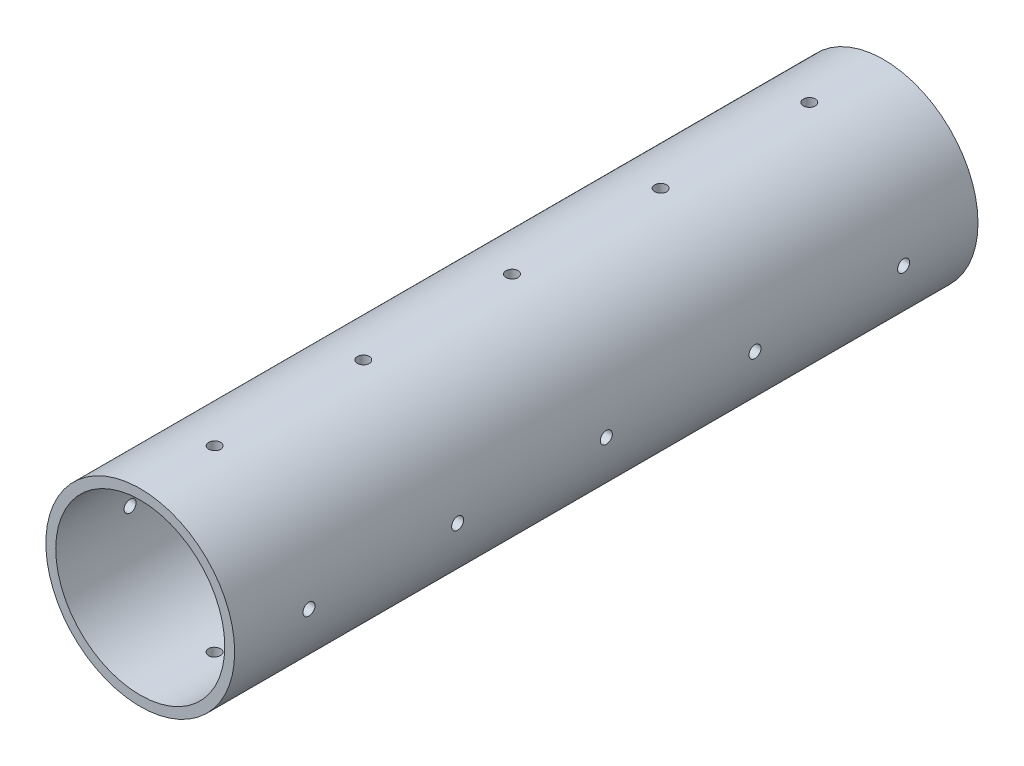
from build123d import *

# Parameters (mm, degrees)
SKETCH1_R                           = 15.875
SKETCH1_R_2                         = 14.210807843
BOSS_EXTRUDE1_DEPTH                 = 125
CUT_EXTRUDE1_REACH                  = 129
CUT_EXTRUDE1_END_RADIUS             = 15.875
SKETCH2_R                           = 1.0125
CUT_EXTRUDE1_DIRECTION_2_REACH      = 129
CUT_EXTRUDE1_DIRECTION_2_END_RADIUS = 15.875
CUT_EXTRUDE2_REACH                  = 129
CUT_EXTRUDE2_END_RADIUS             = 15.875
SKETCH3_R                           = 1.0125
CUT_EXTRUDE2_DIRECTION_2_REACH      = 129
CUT_EXTRUDE2_DIRECTION_2_END_RADIUS = 15.875


with BuildPart() as part:
    # Sketch1 → Boss-Extrude1 (new body)
    with BuildSketch(Plane.XY):
        Circle(SKETCH1_R)
        Circle(SKETCH1_R_2, mode=Mode.SUBTRACT)
    extrude(amount=BOSS_EXTRUDE1_DEPTH)

    # Cut-Extrude1: up to this cylinder (the profile starts inside it)
    cut_extrude1_end = Plane(origin=(0, 0, 150), z_dir=(0, 0, -1)) * Cylinder(CUT_EXTRUDE1_END_RADIUS, 565.75, mode=Mode.PRIVATE)
    # Sketch2 → Cut-Extrude1 (cut, up to the surface)
    with BuildSketch(Plane(origin=(0, 0, 0), x_dir=(1, 0, 0), z_dir=(0, 1, 0)), mode=Mode.PRIVATE) as cut_extrude1_sk1:
        with Locations(Location((0, -12.5, 0), (0, 0, 270))):
            Circle(SKETCH2_R)
    cut_extrude1_tool1 = extrude(cut_extrude1_sk1.sketch, amount=-CUT_EXTRUDE1_REACH, mode=Mode.PRIVATE) & cut_extrude1_end
    add(cut_extrude1_tool1.solids().sort_by_distance((0, 0, 12.5))[0], mode=Mode.SUBTRACT)
    # Sketch2 → Cut-Extrude1 (cut, up to the surface)
    with BuildSketch(Plane(origin=(0, 0, 0), x_dir=(1, 0, 0), z_dir=(0, 1, 0)), mode=Mode.PRIVATE) as cut_extrude1_sk2:
        with Locations(Location((0, -37.5, 0), (0, 0, 270))):
            Circle(SKETCH2_R)
    cut_extrude1_tool2 = extrude(cut_extrude1_sk2.sketch, amount=-CUT_EXTRUDE1_REACH, mode=Mode.PRIVATE) & cut_extrude1_end
    add(cut_extrude1_tool2.solids().sort_by_distance((0, 0, 37.5))[0], mode=Mode.SUBTRACT)
    # Sketch2 → Cut-Extrude1 (cut, up to the surface)
    with BuildSketch(Plane(origin=(0, 0, 0), x_dir=(1, 0, 0), z_dir=(0, 1, 0)), mode=Mode.PRIVATE) as cut_extrude1_sk3:
        with Locations(Location((0, -62.5, 0), (0, 0, 270))):
            Circle(SKETCH2_R)
    cut_extrude1_tool3 = extrude(cut_extrude1_sk3.sketch, amount=-CUT_EXTRUDE1_REACH, mode=Mode.PRIVATE) & cut_extrude1_end
    add(cut_extrude1_tool3.solids().sort_by_distance((0, 0, 62.5))[0], mode=Mode.SUBTRACT)
    # Sketch2 → Cut-Extrude1 (cut, up to the surface)
    with BuildSketch(Plane(origin=(0, 0, 0), x_dir=(1, 0, 0), z_dir=(0, 1, 0)), mode=Mode.PRIVATE) as cut_extrude1_sk4:
        with Locations(Location((0, -87.5, 0), (0, 0, 270))):
            Circle(SKETCH2_R)
    cut_extrude1_tool4 = extrude(cut_extrude1_sk4.sketch, amount=-CUT_EXTRUDE1_REACH, mode=Mode.PRIVATE) & cut_extrude1_end
    add(cut_extrude1_tool4.solids().sort_by_distance((0, 0, 87.5))[0], mode=Mode.SUBTRACT)
    # Sketch2 → Cut-Extrude1 (cut, up to the surface)
    with BuildSketch(Plane(origin=(0, 0, 0), x_dir=(1, 0, 0), z_dir=(0, 1, 0)), mode=Mode.PRIVATE) as cut_extrude1_sk5:
        with Locations(Location((0, -112.5, 0), (0, 0, 270))):
            Circle(SKETCH2_R)
    cut_extrude1_tool5 = extrude(cut_extrude1_sk5.sketch, amount=-CUT_EXTRUDE1_REACH, mode=Mode.PRIVATE) & cut_extrude1_end
    add(cut_extrude1_tool5.solids().sort_by_distance((0, 0, 112.5))[0], mode=Mode.SUBTRACT)
    # Sketch2 → Cut-Extrude1 (cut, up to the surface)
    with BuildSketch(Plane(origin=(0, 0, 0), x_dir=(1, 0, 0), z_dir=(0, 1, 0)), mode=Mode.PRIVATE) as cut_extrude1_sk6:
        with Locations((0, -137.5)):
            Circle(SKETCH2_R)
    cut_extrude1_tool6 = extrude(cut_extrude1_sk6.sketch, amount=-CUT_EXTRUDE1_REACH, mode=Mode.PRIVATE) & cut_extrude1_end
    add(cut_extrude1_tool6.solids().sort_by_distance((0, 0, 137.5))[0], mode=Mode.SUBTRACT)
    # Sketch2 → Cut-Extrude1 (cut, up to the surface)
    with BuildSketch(Plane(origin=(0, 0, 0), x_dir=(1, 0, 0), z_dir=(0, 1, 0)), mode=Mode.PRIVATE) as cut_extrude1_sk7:
        with Locations((0, -162.5)):
            Circle(SKETCH2_R)
    cut_extrude1_tool7 = extrude(cut_extrude1_sk7.sketch, amount=-CUT_EXTRUDE1_REACH, mode=Mode.PRIVATE) & cut_extrude1_end
    add(cut_extrude1_tool7.solids().sort_by_distance((0, 0, 162.5))[0], mode=Mode.SUBTRACT)
    # Sketch2 → Cut-Extrude1 (cut, up to the surface)
    with BuildSketch(Plane(origin=(0, 0, 0), x_dir=(1, 0, 0), z_dir=(0, 1, 0)), mode=Mode.PRIVATE) as cut_extrude1_sk8:
        with Locations((0, -187.5)):
            Circle(SKETCH2_R)
    cut_extrude1_tool8 = extrude(cut_extrude1_sk8.sketch, amount=-CUT_EXTRUDE1_REACH, mode=Mode.PRIVATE) & cut_extrude1_end
    add(cut_extrude1_tool8.solids().sort_by_distance((0, 0, 187.5))[0], mode=Mode.SUBTRACT)
    # Sketch2 → Cut-Extrude1 (cut, up to the surface)
    with BuildSketch(Plane(origin=(0, 0, 0), x_dir=(1, 0, 0), z_dir=(0, 1, 0)), mode=Mode.PRIVATE) as cut_extrude1_sk9:
        with Locations((0, -212.5)):
            Circle(SKETCH2_R)
    cut_extrude1_tool9 = extrude(cut_extrude1_sk9.sketch, amount=-CUT_EXTRUDE1_REACH, mode=Mode.PRIVATE) & cut_extrude1_end
    add(cut_extrude1_tool9.solids().sort_by_distance((0, 0, 212.5))[0], mode=Mode.SUBTRACT)
    # Sketch2 → Cut-Extrude1 (cut, up to the surface)
    with BuildSketch(Plane(origin=(0, 0, 0), x_dir=(1, 0, 0), z_dir=(0, 1, 0)), mode=Mode.PRIVATE) as cut_extrude1_sk10:
        with Locations((0, -237.5)):
            Circle(SKETCH2_R)
    cut_extrude1_tool10 = extrude(cut_extrude1_sk10.sketch, amount=-CUT_EXTRUDE1_REACH, mode=Mode.PRIVATE) & cut_extrude1_end
    add(cut_extrude1_tool10.solids().sort_by_distance((0, 0, 237.5))[0], mode=Mode.SUBTRACT)
    # Sketch2 → Cut-Extrude1 (cut, up to the surface)
    with BuildSketch(Plane(origin=(0, 0, 0), x_dir=(1, 0, 0), z_dir=(0, 1, 0)), mode=Mode.PRIVATE) as cut_extrude1_sk11:
        with Locations((0, -262.5)):
            Circle(SKETCH2_R)
    cut_extrude1_tool11 = extrude(cut_extrude1_sk11.sketch, amount=-CUT_EXTRUDE1_REACH, mode=Mode.PRIVATE) & cut_extrude1_end
    add(cut_extrude1_tool11.solids().sort_by_distance((0, 0, 262.5))[0], mode=Mode.SUBTRACT)
    # Sketch2 → Cut-Extrude1 (cut, up to the surface)
    with BuildSketch(Plane(origin=(0, 0, 0), x_dir=(1, 0, 0), z_dir=(0, 1, 0)), mode=Mode.PRIVATE) as cut_extrude1_sk12:
        with Locations((0, -287.5)):
            Circle(SKETCH2_R)
    cut_extrude1_tool12 = extrude(cut_extrude1_sk12.sketch, amount=-CUT_EXTRUDE1_REACH, mode=Mode.PRIVATE) & cut_extrude1_end
    add(cut_extrude1_tool12.solids().sort_by_distance((0, 0, 287.5))[0], mode=Mode.SUBTRACT)

    # Cut-Extrude1 direction 2: up to this cylinder (the profile starts inside it)
    cut_extrude1_direction_2_end = Plane(origin=(0, 0, 150), z_dir=(0, 0, -1)) * Cylinder(CUT_EXTRUDE1_DIRECTION_2_END_RADIUS, 565.75, mode=Mode.PRIVATE)
    # Sketch2 → Cut-Extrude1 direction 2 (cut, up to the surface)
    with BuildSketch(Plane(origin=(0, 0, 0), x_dir=(1, 0, 0), z_dir=(0, 1, 0)), mode=Mode.PRIVATE) as cut_extrude1_direction_2_sk1:
        with Locations(Location((0, -12.5, 0), (0, 0, 270))):
            Circle(SKETCH2_R)
    cut_extrude1_direction_2_tool1 = extrude(cut_extrude1_direction_2_sk1.sketch, amount=CUT_EXTRUDE1_DIRECTION_2_REACH, mode=Mode.PRIVATE) & cut_extrude1_direction_2_end
    add(cut_extrude1_direction_2_tool1.solids().sort_by_distance((0, 0, 12.5))[0], mode=Mode.SUBTRACT)
    # Sketch2 → Cut-Extrude1 direction 2 (cut, up to the surface)
    with BuildSketch(Plane(origin=(0, 0, 0), x_dir=(1, 0, 0), z_dir=(0, 1, 0)), mode=Mode.PRIVATE) as cut_extrude1_direction_2_sk2:
        with Locations(Location((0, -37.5, 0), (0, 0, 270))):
            Circle(SKETCH2_R)
    cut_extrude1_direction_2_tool2 = extrude(cut_extrude1_direction_2_sk2.sketch, amount=CUT_EXTRUDE1_DIRECTION_2_REACH, mode=Mode.PRIVATE) & cut_extrude1_direction_2_end
    add(cut_extrude1_direction_2_tool2.solids().sort_by_distance((0, 0, 37.5))[0], mode=Mode.SUBTRACT)
    # Sketch2 → Cut-Extrude1 direction 2 (cut, up to the surface)
    with BuildSketch(Plane(origin=(0, 0, 0), x_dir=(1, 0, 0), z_dir=(0, 1, 0)), mode=Mode.PRIVATE) as cut_extrude1_direction_2_sk3:
        with Locations(Location((0, -62.5, 0), (0, 0, 270))):
            Circle(SKETCH2_R)
    cut_extrude1_direction_2_tool3 = extrude(cut_extrude1_direction_2_sk3.sketch, amount=CUT_EXTRUDE1_DIRECTION_2_REACH, mode=Mode.PRIVATE) & cut_extrude1_direction_2_end
    add(cut_extrude1_direction_2_tool3.solids().sort_by_distance((0, 0, 62.5))[0], mode=Mode.SUBTRACT)
    # Sketch2 → Cut-Extrude1 direction 2 (cut, up to the surface)
    with BuildSketch(Plane(origin=(0, 0, 0), x_dir=(1, 0, 0), z_dir=(0, 1, 0)), mode=Mode.PRIVATE) as cut_extrude1_direction_2_sk4:
        with Locations(Location((0, -87.5, 0), (0, 0, 270))):
            Circle(SKETCH2_R)
    cut_extrude1_direction_2_tool4 = extrude(cut_extrude1_direction_2_sk4.sketch, amount=CUT_EXTRUDE1_DIRECTION_2_REACH, mode=Mode.PRIVATE) & cut_extrude1_direction_2_end
    add(cut_extrude1_direction_2_tool4.solids().sort_by_distance((0, 0, 87.5))[0], mode=Mode.SUBTRACT)
    # Sketch2 → Cut-Extrude1 direction 2 (cut, up to the surface)
    with BuildSketch(Plane(origin=(0, 0, 0), x_dir=(1, 0, 0), z_dir=(0, 1, 0)), mode=Mode.PRIVATE) as cut_extrude1_direction_2_sk5:
        with Locations(Location((0, -112.5, 0), (0, 0, 270))):
            Circle(SKETCH2_R)
    cut_extrude1_direction_2_tool5 = extrude(cut_extrude1_direction_2_sk5.sketch, amount=CUT_EXTRUDE1_DIRECTION_2_REACH, mode=Mode.PRIVATE) & cut_extrude1_direction_2_end
    add(cut_extrude1_direction_2_tool5.solids().sort_by_distance((0, 0, 112.5))[0], mode=Mode.SUBTRACT)
    # Sketch2 → Cut-Extrude1 direction 2 (cut, up to the surface)
    with BuildSketch(Plane(origin=(0, 0, 0), x_dir=(1, 0, 0), z_dir=(0, 1, 0)), mode=Mode.PRIVATE) as cut_extrude1_direction_2_sk6:
        with Locations((0, -137.5)):
            Circle(SKETCH2_R)
    cut_extrude1_direction_2_tool6 = extrude(cut_extrude1_direction_2_sk6.sketch, amount=CUT_EXTRUDE1_DIRECTION_2_REACH, mode=Mode.PRIVATE) & cut_extrude1_direction_2_end
    add(cut_extrude1_direction_2_tool6.solids().sort_by_distance((0, 0, 137.5))[0], mode=Mode.SUBTRACT)
    # Sketch2 → Cut-Extrude1 direction 2 (cut, up to the surface)
    with BuildSketch(Plane(origin=(0, 0, 0), x_dir=(1, 0, 0), z_dir=(0, 1, 0)), mode=Mode.PRIVATE) as cut_extrude1_direction_2_sk7:
        with Locations((0, -162.5)):
            Circle(SKETCH2_R)
    cut_extrude1_direction_2_tool7 = extrude(cut_extrude1_direction_2_sk7.sketch, amount=CUT_EXTRUDE1_DIRECTION_2_REACH, mode=Mode.PRIVATE) & cut_extrude1_direction_2_end
    add(cut_extrude1_direction_2_tool7.solids().sort_by_distance((0, 0, 162.5))[0], mode=Mode.SUBTRACT)
    # Sketch2 → Cut-Extrude1 direction 2 (cut, up to the surface)
    with BuildSketch(Plane(origin=(0, 0, 0), x_dir=(1, 0, 0), z_dir=(0, 1, 0)), mode=Mode.PRIVATE) as cut_extrude1_direction_2_sk8:
        with Locations((0, -187.5)):
            Circle(SKETCH2_R)
    cut_extrude1_direction_2_tool8 = extrude(cut_extrude1_direction_2_sk8.sketch, amount=CUT_EXTRUDE1_DIRECTION_2_REACH, mode=Mode.PRIVATE) & cut_extrude1_direction_2_end
    add(cut_extrude1_direction_2_tool8.solids().sort_by_distance((0, 0, 187.5))[0], mode=Mode.SUBTRACT)
    # Sketch2 → Cut-Extrude1 direction 2 (cut, up to the surface)
    with BuildSketch(Plane(origin=(0, 0, 0), x_dir=(1, 0, 0), z_dir=(0, 1, 0)), mode=Mode.PRIVATE) as cut_extrude1_direction_2_sk9:
        with Locations((0, -212.5)):
            Circle(SKETCH2_R)
    cut_extrude1_direction_2_tool9 = extrude(cut_extrude1_direction_2_sk9.sketch, amount=CUT_EXTRUDE1_DIRECTION_2_REACH, mode=Mode.PRIVATE) & cut_extrude1_direction_2_end
    add(cut_extrude1_direction_2_tool9.solids().sort_by_distance((0, 0, 212.5))[0], mode=Mode.SUBTRACT)
    # Sketch2 → Cut-Extrude1 direction 2 (cut, up to the surface)
    with BuildSketch(Plane(origin=(0, 0, 0), x_dir=(1, 0, 0), z_dir=(0, 1, 0)), mode=Mode.PRIVATE) as cut_extrude1_direction_2_sk10:
        with Locations((0, -237.5)):
            Circle(SKETCH2_R)
    cut_extrude1_direction_2_tool10 = extrude(cut_extrude1_direction_2_sk10.sketch, amount=CUT_EXTRUDE1_DIRECTION_2_REACH, mode=Mode.PRIVATE) & cut_extrude1_direction_2_end
    add(cut_extrude1_direction_2_tool10.solids().sort_by_distance((0, 0, 237.5))[0], mode=Mode.SUBTRACT)
    # Sketch2 → Cut-Extrude1 direction 2 (cut, up to the surface)
    with BuildSketch(Plane(origin=(0, 0, 0), x_dir=(1, 0, 0), z_dir=(0, 1, 0)), mode=Mode.PRIVATE) as cut_extrude1_direction_2_sk11:
        with Locations((0, -262.5)):
            Circle(SKETCH2_R)
    cut_extrude1_direction_2_tool11 = extrude(cut_extrude1_direction_2_sk11.sketch, amount=CUT_EXTRUDE1_DIRECTION_2_REACH, mode=Mode.PRIVATE) & cut_extrude1_direction_2_end
    add(cut_extrude1_direction_2_tool11.solids().sort_by_distance((0, 0, 262.5))[0], mode=Mode.SUBTRACT)
    # Sketch2 → Cut-Extrude1 direction 2 (cut, up to the surface)
    with BuildSketch(Plane(origin=(0, 0, 0), x_dir=(1, 0, 0), z_dir=(0, 1, 0)), mode=Mode.PRIVATE) as cut_extrude1_direction_2_sk12:
        with Locations((0, -287.5)):
            Circle(SKETCH2_R)
    cut_extrude1_direction_2_tool12 = extrude(cut_extrude1_direction_2_sk12.sketch, amount=CUT_EXTRUDE1_DIRECTION_2_REACH, mode=Mode.PRIVATE) & cut_extrude1_direction_2_end
    add(cut_extrude1_direction_2_tool12.solids().sort_by_distance((0, 0, 287.5))[0], mode=Mode.SUBTRACT)

    # Cut-Extrude2: up to this cylinder (the profile starts inside it)
    cut_extrude2_end = Plane(origin=(0, 0, 150), z_dir=(0, 0, -1)) * Cylinder(CUT_EXTRUDE2_END_RADIUS, 565.75, mode=Mode.PRIVATE)
    # Sketch3 → Cut-Extrude2 (cut, up to the surface)
    with BuildSketch(Plane(origin=(0, 0, 0), x_dir=(0, 0, -1), z_dir=(1, 0, 0)), mode=Mode.PRIVATE) as cut_extrude2_sk1:
        with Locations((-12.5, 0)):
            Circle(SKETCH3_R)
    cut_extrude2_tool1 = extrude(cut_extrude2_sk1.sketch, amount=-CUT_EXTRUDE2_REACH, mode=Mode.PRIVATE) & cut_extrude2_end
    add(cut_extrude2_tool1.solids().sort_by_distance((0, 0, 12.5))[0], mode=Mode.SUBTRACT)
    # Sketch3 → Cut-Extrude2 (cut, up to the surface)
    with BuildSketch(Plane(origin=(0, 0, 0), x_dir=(0, 0, -1), z_dir=(1, 0, 0)), mode=Mode.PRIVATE) as cut_extrude2_sk2:
        with Locations((-37.5, 0)):
            Circle(SKETCH3_R)
    cut_extrude2_tool2 = extrude(cut_extrude2_sk2.sketch, amount=-CUT_EXTRUDE2_REACH, mode=Mode.PRIVATE) & cut_extrude2_end
    add(cut_extrude2_tool2.solids().sort_by_distance((0, 0, 37.5))[0], mode=Mode.SUBTRACT)
    # Sketch3 → Cut-Extrude2 (cut, up to the surface)
    with BuildSketch(Plane(origin=(0, 0, 0), x_dir=(0, 0, -1), z_dir=(1, 0, 0)), mode=Mode.PRIVATE) as cut_extrude2_sk3:
        with Locations((-62.5, 0)):
            Circle(SKETCH3_R)
    cut_extrude2_tool3 = extrude(cut_extrude2_sk3.sketch, amount=-CUT_EXTRUDE2_REACH, mode=Mode.PRIVATE) & cut_extrude2_end
    add(cut_extrude2_tool3.solids().sort_by_distance((0, 0, 62.5))[0], mode=Mode.SUBTRACT)
    # Sketch3 → Cut-Extrude2 (cut, up to the surface)
    with BuildSketch(Plane(origin=(0, 0, 0), x_dir=(0, 0, -1), z_dir=(1, 0, 0)), mode=Mode.PRIVATE) as cut_extrude2_sk4:
        with Locations((-87.5, 0)):
            Circle(SKETCH3_R)
    cut_extrude2_tool4 = extrude(cut_extrude2_sk4.sketch, amount=-CUT_EXTRUDE2_REACH, mode=Mode.PRIVATE) & cut_extrude2_end
    add(cut_extrude2_tool4.solids().sort_by_distance((0, 0, 87.5))[0], mode=Mode.SUBTRACT)
    # Sketch3 → Cut-Extrude2 (cut, up to the surface)
    with BuildSketch(Plane(origin=(0, 0, 0), x_dir=(0, 0, -1), z_dir=(1, 0, 0)), mode=Mode.PRIVATE) as cut_extrude2_sk5:
        with Locations((-112.5, 0)):
            Circle(SKETCH3_R)
    cut_extrude2_tool5 = extrude(cut_extrude2_sk5.sketch, amount=-CUT_EXTRUDE2_REACH, mode=Mode.PRIVATE) & cut_extrude2_end
    add(cut_extrude2_tool5.solids().sort_by_distance((0, 0, 112.5))[0], mode=Mode.SUBTRACT)
    # Sketch3 → Cut-Extrude2 (cut, up to the surface)
    with BuildSketch(Plane(origin=(0, 0, 0), x_dir=(0, 0, -1), z_dir=(1, 0, 0)), mode=Mode.PRIVATE) as cut_extrude2_sk6:
        with Locations((-137.5, 0)):
            Circle(SKETCH3_R)
    cut_extrude2_tool6 = extrude(cut_extrude2_sk6.sketch, amount=-CUT_EXTRUDE2_REACH, mode=Mode.PRIVATE) & cut_extrude2_end
    add(cut_extrude2_tool6.solids().sort_by_distance((0, 0, 137.5))[0], mode=Mode.SUBTRACT)
    # Sketch3 → Cut-Extrude2 (cut, up to the surface)
    with BuildSketch(Plane(origin=(0, 0, 0), x_dir=(0, 0, -1), z_dir=(1, 0, 0)), mode=Mode.PRIVATE) as cut_extrude2_sk7:
        with Locations((-162.5, 0)):
            Circle(SKETCH3_R)
    cut_extrude2_tool7 = extrude(cut_extrude2_sk7.sketch, amount=-CUT_EXTRUDE2_REACH, mode=Mode.PRIVATE) & cut_extrude2_end
    add(cut_extrude2_tool7.solids().sort_by_distance((0, 0, 162.5))[0], mode=Mode.SUBTRACT)
    # Sketch3 → Cut-Extrude2 (cut, up to the surface)
    with BuildSketch(Plane(origin=(0, 0, 0), x_dir=(0, 0, -1), z_dir=(1, 0, 0)), mode=Mode.PRIVATE) as cut_extrude2_sk8:
        with Locations((-187.5, 0)):
            Circle(SKETCH3_R)
    cut_extrude2_tool8 = extrude(cut_extrude2_sk8.sketch, amount=-CUT_EXTRUDE2_REACH, mode=Mode.PRIVATE) & cut_extrude2_end
    add(cut_extrude2_tool8.solids().sort_by_distance((0, 0, 187.5))[0], mode=Mode.SUBTRACT)
    # Sketch3 → Cut-Extrude2 (cut, up to the surface)
    with BuildSketch(Plane(origin=(0, 0, 0), x_dir=(0, 0, -1), z_dir=(1, 0, 0)), mode=Mode.PRIVATE) as cut_extrude2_sk9:
        with Locations((-212.5, 0)):
            Circle(SKETCH3_R)
    cut_extrude2_tool9 = extrude(cut_extrude2_sk9.sketch, amount=-CUT_EXTRUDE2_REACH, mode=Mode.PRIVATE) & cut_extrude2_end
    add(cut_extrude2_tool9.solids().sort_by_distance((0, 0, 212.5))[0], mode=Mode.SUBTRACT)
    # Sketch3 → Cut-Extrude2 (cut, up to the surface)
    with BuildSketch(Plane(origin=(0, 0, 0), x_dir=(0, 0, -1), z_dir=(1, 0, 0)), mode=Mode.PRIVATE) as cut_extrude2_sk10:
        with Locations((-237.5, 0)):
            Circle(SKETCH3_R)
    cut_extrude2_tool10 = extrude(cut_extrude2_sk10.sketch, amount=-CUT_EXTRUDE2_REACH, mode=Mode.PRIVATE) & cut_extrude2_end
    add(cut_extrude2_tool10.solids().sort_by_distance((0, 0, 237.5))[0], mode=Mode.SUBTRACT)
    # Sketch3 → Cut-Extrude2 (cut, up to the surface)
    with BuildSketch(Plane(origin=(0, 0, 0), x_dir=(0, 0, -1), z_dir=(1, 0, 0)), mode=Mode.PRIVATE) as cut_extrude2_sk11:
        with Locations((-262.5, 0)):
            Circle(SKETCH3_R)
    cut_extrude2_tool11 = extrude(cut_extrude2_sk11.sketch, amount=-CUT_EXTRUDE2_REACH, mode=Mode.PRIVATE) & cut_extrude2_end
    add(cut_extrude2_tool11.solids().sort_by_distance((0, 0, 262.5))[0], mode=Mode.SUBTRACT)
    # Sketch3 → Cut-Extrude2 (cut, up to the surface)
    with BuildSketch(Plane(origin=(0, 0, 0), x_dir=(0, 0, -1), z_dir=(1, 0, 0)), mode=Mode.PRIVATE) as cut_extrude2_sk12:
        with Locations((-287.5, 0)):
            Circle(SKETCH3_R)
    cut_extrude2_tool12 = extrude(cut_extrude2_sk12.sketch, amount=-CUT_EXTRUDE2_REACH, mode=Mode.PRIVATE) & cut_extrude2_end
    add(cut_extrude2_tool12.solids().sort_by_distance((0, 0, 287.5))[0], mode=Mode.SUBTRACT)

    # Cut-Extrude2 direction 2: up to this cylinder (the profile starts inside it)
    cut_extrude2_direction_2_end = Plane(origin=(0, 0, 150), z_dir=(0, 0, -1)) * Cylinder(CUT_EXTRUDE2_DIRECTION_2_END_RADIUS, 565.75, mode=Mode.PRIVATE)
    # Sketch3 → Cut-Extrude2 direction 2 (cut, up to the surface)
    with BuildSketch(Plane(origin=(0, 0, 0), x_dir=(0, 0, -1), z_dir=(1, 0, 0)), mode=Mode.PRIVATE) as cut_extrude2_direction_2_sk1:
        with Locations((-12.5, 0)):
            Circle(SKETCH3_R)
    cut_extrude2_direction_2_tool1 = extrude(cut_extrude2_direction_2_sk1.sketch, amount=CUT_EXTRUDE2_DIRECTION_2_REACH, mode=Mode.PRIVATE) & cut_extrude2_direction_2_end
    add(cut_extrude2_direction_2_tool1.solids().sort_by_distance((0, 0, 12.5))[0], mode=Mode.SUBTRACT)
    # Sketch3 → Cut-Extrude2 direction 2 (cut, up to the surface)
    with BuildSketch(Plane(origin=(0, 0, 0), x_dir=(0, 0, -1), z_dir=(1, 0, 0)), mode=Mode.PRIVATE) as cut_extrude2_direction_2_sk2:
        with Locations((-37.5, 0)):
            Circle(SKETCH3_R)
    cut_extrude2_direction_2_tool2 = extrude(cut_extrude2_direction_2_sk2.sketch, amount=CUT_EXTRUDE2_DIRECTION_2_REACH, mode=Mode.PRIVATE) & cut_extrude2_direction_2_end
    add(cut_extrude2_direction_2_tool2.solids().sort_by_distance((0, 0, 37.5))[0], mode=Mode.SUBTRACT)
    # Sketch3 → Cut-Extrude2 direction 2 (cut, up to the surface)
    with BuildSketch(Plane(origin=(0, 0, 0), x_dir=(0, 0, -1), z_dir=(1, 0, 0)), mode=Mode.PRIVATE) as cut_extrude2_direction_2_sk3:
        with Locations((-62.5, 0)):
            Circle(SKETCH3_R)
    cut_extrude2_direction_2_tool3 = extrude(cut_extrude2_direction_2_sk3.sketch, amount=CUT_EXTRUDE2_DIRECTION_2_REACH, mode=Mode.PRIVATE) & cut_extrude2_direction_2_end
    add(cut_extrude2_direction_2_tool3.solids().sort_by_distance((0, 0, 62.5))[0], mode=Mode.SUBTRACT)
    # Sketch3 → Cut-Extrude2 direction 2 (cut, up to the surface)
    with BuildSketch(Plane(origin=(0, 0, 0), x_dir=(0, 0, -1), z_dir=(1, 0, 0)), mode=Mode.PRIVATE) as cut_extrude2_direction_2_sk4:
        with Locations((-87.5, 0)):
            Circle(SKETCH3_R)
    cut_extrude2_direction_2_tool4 = extrude(cut_extrude2_direction_2_sk4.sketch, amount=CUT_EXTRUDE2_DIRECTION_2_REACH, mode=Mode.PRIVATE) & cut_extrude2_direction_2_end
    add(cut_extrude2_direction_2_tool4.solids().sort_by_distance((0, 0, 87.5))[0], mode=Mode.SUBTRACT)
    # Sketch3 → Cut-Extrude2 direction 2 (cut, up to the surface)
    with BuildSketch(Plane(origin=(0, 0, 0), x_dir=(0, 0, -1), z_dir=(1, 0, 0)), mode=Mode.PRIVATE) as cut_extrude2_direction_2_sk5:
        with Locations((-112.5, 0)):
            Circle(SKETCH3_R)
    cut_extrude2_direction_2_tool5 = extrude(cut_extrude2_direction_2_sk5.sketch, amount=CUT_EXTRUDE2_DIRECTION_2_REACH, mode=Mode.PRIVATE) & cut_extrude2_direction_2_end
    add(cut_extrude2_direction_2_tool5.solids().sort_by_distance((0, 0, 112.5))[0], mode=Mode.SUBTRACT)
    # Sketch3 → Cut-Extrude2 direction 2 (cut, up to the surface)
    with BuildSketch(Plane(origin=(0, 0, 0), x_dir=(0, 0, -1), z_dir=(1, 0, 0)), mode=Mode.PRIVATE) as cut_extrude2_direction_2_sk6:
        with Locations((-137.5, 0)):
            Circle(SKETCH3_R)
    cut_extrude2_direction_2_tool6 = extrude(cut_extrude2_direction_2_sk6.sketch, amount=CUT_EXTRUDE2_DIRECTION_2_REACH, mode=Mode.PRIVATE) & cut_extrude2_direction_2_end
    add(cut_extrude2_direction_2_tool6.solids().sort_by_distance((0, 0, 137.5))[0], mode=Mode.SUBTRACT)
    # Sketch3 → Cut-Extrude2 direction 2 (cut, up to the surface)
    with BuildSketch(Plane(origin=(0, 0, 0), x_dir=(0, 0, -1), z_dir=(1, 0, 0)), mode=Mode.PRIVATE) as cut_extrude2_direction_2_sk7:
        with Locations((-162.5, 0)):
            Circle(SKETCH3_R)
    cut_extrude2_direction_2_tool7 = extrude(cut_extrude2_direction_2_sk7.sketch, amount=CUT_EXTRUDE2_DIRECTION_2_REACH, mode=Mode.PRIVATE) & cut_extrude2_direction_2_end
    add(cut_extrude2_direction_2_tool7.solids().sort_by_distance((0, 0, 162.5))[0], mode=Mode.SUBTRACT)
    # Sketch3 → Cut-Extrude2 direction 2 (cut, up to the surface)
    with BuildSketch(Plane(origin=(0, 0, 0), x_dir=(0, 0, -1), z_dir=(1, 0, 0)), mode=Mode.PRIVATE) as cut_extrude2_direction_2_sk8:
        with Locations((-187.5, 0)):
            Circle(SKETCH3_R)
    cut_extrude2_direction_2_tool8 = extrude(cut_extrude2_direction_2_sk8.sketch, amount=CUT_EXTRUDE2_DIRECTION_2_REACH, mode=Mode.PRIVATE) & cut_extrude2_direction_2_end
    add(cut_extrude2_direction_2_tool8.solids().sort_by_distance((0, 0, 187.5))[0], mode=Mode.SUBTRACT)
    # Sketch3 → Cut-Extrude2 direction 2 (cut, up to the surface)
    with BuildSketch(Plane(origin=(0, 0, 0), x_dir=(0, 0, -1), z_dir=(1, 0, 0)), mode=Mode.PRIVATE) as cut_extrude2_direction_2_sk9:
        with Locations((-212.5, 0)):
            Circle(SKETCH3_R)
    cut_extrude2_direction_2_tool9 = extrude(cut_extrude2_direction_2_sk9.sketch, amount=CUT_EXTRUDE2_DIRECTION_2_REACH, mode=Mode.PRIVATE) & cut_extrude2_direction_2_end
    add(cut_extrude2_direction_2_tool9.solids().sort_by_distance((0, 0, 212.5))[0], mode=Mode.SUBTRACT)
    # Sketch3 → Cut-Extrude2 direction 2 (cut, up to the surface)
    with BuildSketch(Plane(origin=(0, 0, 0), x_dir=(0, 0, -1), z_dir=(1, 0, 0)), mode=Mode.PRIVATE) as cut_extrude2_direction_2_sk10:
        with Locations((-237.5, 0)):
            Circle(SKETCH3_R)
    cut_extrude2_direction_2_tool10 = extrude(cut_extrude2_direction_2_sk10.sketch, amount=CUT_EXTRUDE2_DIRECTION_2_REACH, mode=Mode.PRIVATE) & cut_extrude2_direction_2_end
    add(cut_extrude2_direction_2_tool10.solids().sort_by_distance((0, 0, 237.5))[0], mode=Mode.SUBTRACT)
    # Sketch3 → Cut-Extrude2 direction 2 (cut, up to the surface)
    with BuildSketch(Plane(origin=(0, 0, 0), x_dir=(0, 0, -1), z_dir=(1, 0, 0)), mode=Mode.PRIVATE) as cut_extrude2_direction_2_sk11:
        with Locations((-262.5, 0)):
            Circle(SKETCH3_R)
    cut_extrude2_direction_2_tool11 = extrude(cut_extrude2_direction_2_sk11.sketch, amount=CUT_EXTRUDE2_DIRECTION_2_REACH, mode=Mode.PRIVATE) & cut_extrude2_direction_2_end
    add(cut_extrude2_direction_2_tool11.solids().sort_by_distance((0, 0, 262.5))[0], mode=Mode.SUBTRACT)
    # Sketch3 → Cut-Extrude2 direction 2 (cut, up to the surface)
    with BuildSketch(Plane(origin=(0, 0, 0), x_dir=(0, 0, -1), z_dir=(1, 0, 0)), mode=Mode.PRIVATE) as cut_extrude2_direction_2_sk12:
        with Locations((-287.5, 0)):
            Circle(SKETCH3_R)
    cut_extrude2_direction_2_tool12 = extrude(cut_extrude2_direction_2_sk12.sketch, amount=CUT_EXTRUDE2_DIRECTION_2_REACH, mode=Mode.PRIVATE) & cut_extrude2_direction_2_end
    add(cut_extrude2_direction_2_tool12.solids().sort_by_distance((0, 0, 287.5))[0], mode=Mode.SUBTRACT)


solid = part.part
